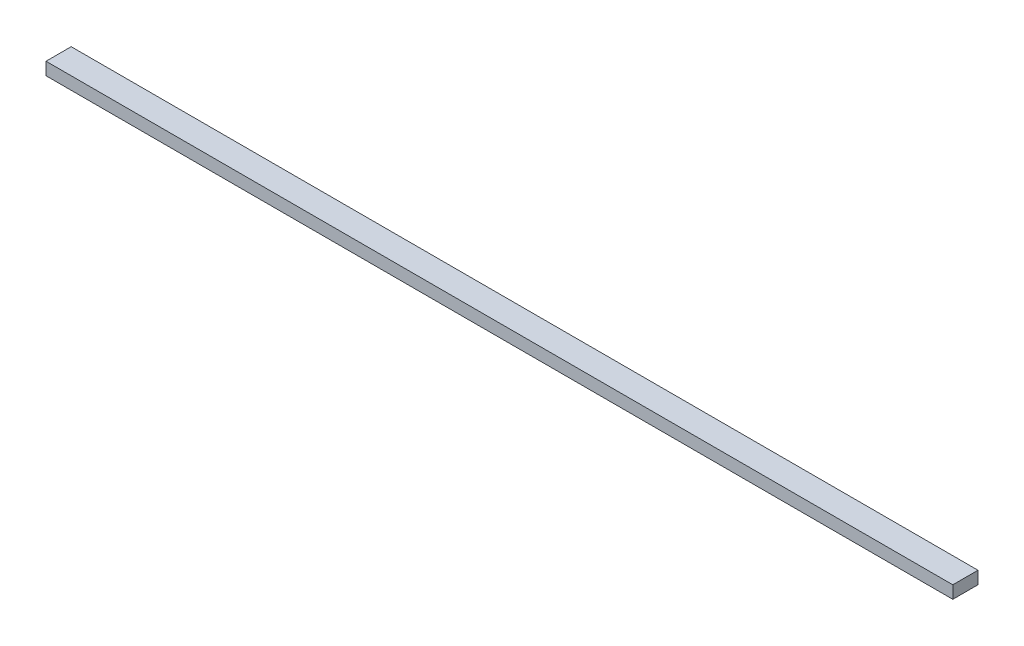
from build123d import *

# Parameters (mm, degrees)
SKETCH_1_W      = 359.9
SKETCH_1_H      = 10
EXTRUDE_1_DEPTH = 5


with BuildPart() as part:
    # 草图1 → 凸台-拉伸1 (new body)
    with BuildSketch(Plane(origin=(0, 0, 0), x_dir=(1, 0, 0), z_dir=(0, 1, 0))):
        with Locations((179.95, -5)):
            Rectangle(SKETCH_1_W, SKETCH_1_H)
    extrude(amount=EXTRUDE_1_DEPTH)


solid = part.part
